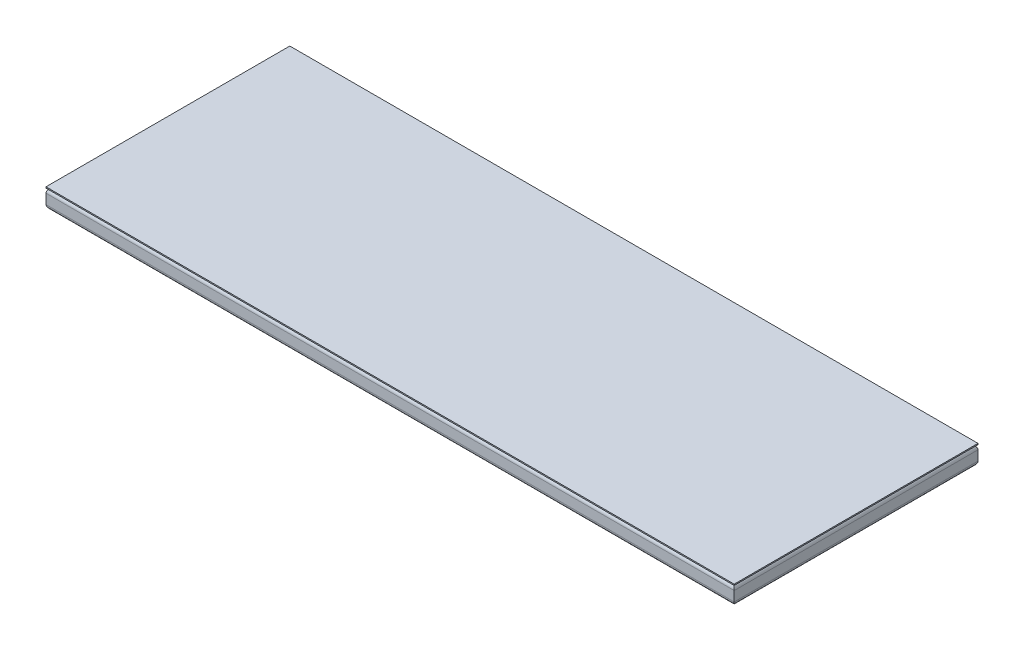
from build123d import *

# Parameters (mm, degrees)
TUBO_CUADRADO_2_X_2_X_0_25_1_DEPTH      = 369.921024484
TUBO_CUADRADO_2_X_2_X_0_25_1_DEPTH_BACK = 36.921024484
TUBO_CUADRADO_2_X_2_X_0_25_1_2_DEPTH    = 1013.842048969
TUBO_CUADRADO_2_X_2_X_0_25_1_3_DEPTH    = 406.842048969
TUBO_CUADRADO_2_X_2_X_0_25_1_4_DEPTH    = 1013.842048969
CROQUIS3_W                              = 940
CROQUIS3_H                              = 333
SALIENTE_EXTRUIR2_DEPTH                 = 1.62


with BuildPart() as part:
    # Sketch1 → Tubo cuadrado 2 X 2 X 0.25(1) (new, two sides: drawn at the far end of the back side and taken through both)
    with BuildSketch(Plane(origin=(457.3, -12.7, -166.5), x_dir=(1, 0, 0), z_dir=(0, 0, 1)).offset(-TUBO_CUADRADO_2_X_2_X_0_25_1_DEPTH_BACK)):
        with BuildLine():
            Line((-6.7, -12.7), (6.7, -12.7))
            ThreePointArc((6.7, -12.7), (10.942640687, -10.942640687), (12.7, -6.7))
            Line((12.7, -6.7), (12.7, 6.7))
            ThreePointArc((12.7, 6.7), (10.942640687, 10.942640687), (6.7, 12.7))
            Line((6.7, 12.7), (-6.7, 12.7))
            ThreePointArc((-6.7, 12.7), (-10.942640687, 10.942640687), (-12.7, 6.7))
            Line((-12.7, 6.7), (-12.7, -6.7))
            ThreePointArc((-12.7, -6.7), (-10.942640687, -10.942640687), (-6.7, -12.7))
        make_face()
        with BuildLine():
            Line((-6.7, -9.7), (6.7, -9.7))
            ThreePointArc((6.7, -9.7), (8.821320344, -8.821320344), (9.7, -6.7))
            Line((9.7, -6.7), (9.7, 6.7))
            ThreePointArc((9.7, 6.7), (8.821320344, 8.821320344), (6.7, 9.7))
            Line((6.7, 9.7), (-6.7, 9.7))
            ThreePointArc((-6.7, 9.7), (-8.821320344, 8.821320344), (-9.7, 6.7))
            Line((-9.7, 6.7), (-9.7, -6.7))
            ThreePointArc((-9.7, -6.7), (-8.821320344, -8.821320344), (-6.7, -9.7))
        make_face(mode=Mode.SUBTRACT)
    extrude(amount=TUBO_CUADRADO_2_X_2_X_0_25_1_DEPTH + TUBO_CUADRADO_2_X_2_X_0_25_1_DEPTH_BACK)

    # Tubo cuadrado 2 X 2 X 0.25(1) mitre 1
    split(bisect_by=Plane(origin=(470, 0, -166.5), x_dir=(0, 1, 0), z_dir=(0.707106781, 0, 0.707106781)), keep=Keep.TOP)

    # Tubo cuadrado 2 X 2 X 0.25(1) mitre 2
    split(bisect_by=Plane(origin=(470, 0, 166.5), x_dir=(0, 1, 0), z_dir=(0.707106781, 0, -0.707106781)), keep=Keep.TOP)


with BuildPart() as body_2:
    # Sketch1 on segment 2 (carried to segment 2) → Tubo cuadrado 2 X 2 X 0.25_1 2 (new body)
    with BuildSketch(Plane(origin=(506.921024484, -12.7, 153.8), x_dir=(0, 0, 1), z_dir=(-1, 0, 0))):
        with BuildLine():
            Line((-6.7, -12.7), (6.7, -12.7))
            ThreePointArc((6.7, -12.7), (10.942640687, -10.942640687), (12.7, -6.7))
            Line((12.7, -6.7), (12.7, 6.7))
            ThreePointArc((12.7, 6.7), (10.942640687, 10.942640687), (6.7, 12.7))
            Line((6.7, 12.7), (-6.7, 12.7))
            ThreePointArc((-6.7, 12.7), (-10.942640687, 10.942640687), (-12.7, 6.7))
            Line((-12.7, 6.7), (-12.7, -6.7))
            ThreePointArc((-12.7, -6.7), (-10.942640687, -10.942640687), (-6.7, -12.7))
        make_face()
        with BuildLine():
            Line((-6.7, -9.7), (6.7, -9.7))
            ThreePointArc((6.7, -9.7), (8.821320344, -8.821320344), (9.7, -6.7))
            Line((9.7, -6.7), (9.7, 6.7))
            ThreePointArc((9.7, 6.7), (8.821320344, 8.821320344), (6.7, 9.7))
            Line((6.7, 9.7), (-6.7, 9.7))
            ThreePointArc((-6.7, 9.7), (-8.821320344, 8.821320344), (-9.7, 6.7))
            Line((-9.7, 6.7), (-9.7, -6.7))
            ThreePointArc((-9.7, -6.7), (-8.821320344, -8.821320344), (-6.7, -9.7))
        make_face(mode=Mode.SUBTRACT)
    extrude(amount=TUBO_CUADRADO_2_X_2_X_0_25_1_2_DEPTH)

    # Tubo cuadrado 2 X 2 X 0.25_1 2 mitre 1
    split(bisect_by=Plane(origin=(-470, 0, 166.5), x_dir=(0, 1, 0), z_dir=(0.707106781, 0, 0.707106781)), keep=Keep.TOP)

    # Tubo cuadrado 2 X 2 X 0.25_1 2 mitre 2
    split(bisect_by=Plane(origin=(470, 0, 166.5), x_dir=(0, -1, 0), z_dir=(-0.707106781, 0, 0.707106781)), keep=Keep.TOP)


with BuildPart() as body_3:
    # Sketch1 on segment 3 (carried to segment 3) → Tubo cuadrado 2 X 2 X 0.25_1 3 (new body)
    with BuildSketch(Plane(origin=(-457.3, -12.7, 203.421024484), x_dir=(-1, 0, 0), z_dir=(0, 0, -1))):
        with BuildLine():
            Line((-6.7, -12.7), (6.7, -12.7))
            ThreePointArc((6.7, -12.7), (10.942640687, -10.942640687), (12.7, -6.7))
            Line((12.7, -6.7), (12.7, 6.7))
            ThreePointArc((12.7, 6.7), (10.942640687, 10.942640687), (6.7, 12.7))
            Line((6.7, 12.7), (-6.7, 12.7))
            ThreePointArc((-6.7, 12.7), (-10.942640687, 10.942640687), (-12.7, 6.7))
            Line((-12.7, 6.7), (-12.7, -6.7))
            ThreePointArc((-12.7, -6.7), (-10.942640687, -10.942640687), (-6.7, -12.7))
        make_face()
        with BuildLine():
            Line((-6.7, -9.7), (6.7, -9.7))
            ThreePointArc((6.7, -9.7), (8.821320344, -8.821320344), (9.7, -6.7))
            Line((9.7, -6.7), (9.7, 6.7))
            ThreePointArc((9.7, 6.7), (8.821320344, 8.821320344), (6.7, 9.7))
            Line((6.7, 9.7), (-6.7, 9.7))
            ThreePointArc((-6.7, 9.7), (-8.821320344, 8.821320344), (-9.7, 6.7))
            Line((-9.7, 6.7), (-9.7, -6.7))
            ThreePointArc((-9.7, -6.7), (-8.821320344, -8.821320344), (-6.7, -9.7))
        make_face(mode=Mode.SUBTRACT)
    extrude(amount=TUBO_CUADRADO_2_X_2_X_0_25_1_3_DEPTH)

    # Tubo cuadrado 2 X 2 X 0.25_1 3 mitre 1
    split(bisect_by=Plane(origin=(-470, 0, -166.5), x_dir=(0, -1, 0), z_dir=(-0.707106781, 0, 0.707106781)), keep=Keep.TOP)

    # Tubo cuadrado 2 X 2 X 0.25_1 3 mitre 2
    split(bisect_by=Plane(origin=(-470, 0, 166.5), x_dir=(0, -1, 0), z_dir=(-0.707106781, 0, -0.707106781)), keep=Keep.TOP)


with BuildPart() as body_4:
    # Sketch1 on segment 4 (carried to segment 4) → Tubo cuadrado 2 X 2 X 0.25_1 4 (new body)
    with BuildSketch(Plane(origin=(-506.921024484, -12.7, -153.8), x_dir=(0, 0, -1), z_dir=(1, 0, 0))):
        with BuildLine():
            Line((-6.7, -12.7), (6.7, -12.7))
            ThreePointArc((6.7, -12.7), (10.942640687, -10.942640687), (12.7, -6.7))
            Line((12.7, -6.7), (12.7, 6.7))
            ThreePointArc((12.7, 6.7), (10.942640687, 10.942640687), (6.7, 12.7))
            Line((6.7, 12.7), (-6.7, 12.7))
            ThreePointArc((-6.7, 12.7), (-10.942640687, 10.942640687), (-12.7, 6.7))
            Line((-12.7, 6.7), (-12.7, -6.7))
            ThreePointArc((-12.7, -6.7), (-10.942640687, -10.942640687), (-6.7, -12.7))
        make_face()
        with BuildLine():
            Line((-6.7, -9.7), (6.7, -9.7))
            ThreePointArc((6.7, -9.7), (8.821320344, -8.821320344), (9.7, -6.7))
            Line((9.7, -6.7), (9.7, 6.7))
            ThreePointArc((9.7, 6.7), (8.821320344, 8.821320344), (6.7, 9.7))
            Line((6.7, 9.7), (-6.7, 9.7))
            ThreePointArc((-6.7, 9.7), (-8.821320344, 8.821320344), (-9.7, 6.7))
            Line((-9.7, 6.7), (-9.7, -6.7))
            ThreePointArc((-9.7, -6.7), (-8.821320344, -8.821320344), (-6.7, -9.7))
        make_face(mode=Mode.SUBTRACT)
    extrude(amount=TUBO_CUADRADO_2_X_2_X_0_25_1_4_DEPTH)

    # Tubo cuadrado 2 X 2 X 0.25_1 4 mitre 1
    split(bisect_by=Plane(origin=(-470, 0, -166.5), x_dir=(0, 1, 0), z_dir=(0.707106781, 0, -0.707106781)), keep=Keep.TOP)

    # Tubo cuadrado 2 X 2 X 0.25_1 4 mitre 2
    split(bisect_by=Plane(origin=(470, 0, -166.5), x_dir=(0, -1, 0), z_dir=(-0.707106781, 0, -0.707106781)), keep=Keep.TOP)


with BuildPart() as body_5:
    # Croquis3 → Saliente-Extruir2 (new body)
    with BuildSketch(Plane(origin=(0, 0, 0), x_dir=(1, 0, 0), z_dir=(0, 1, 0))):
        Rectangle(CROQUIS3_W, CROQUIS3_H)
    extrude(amount=SALIENTE_EXTRUIR2_DEPTH)


solid = Compound([part.part, body_2.part, body_3.part, body_4.part, body_5.part])
